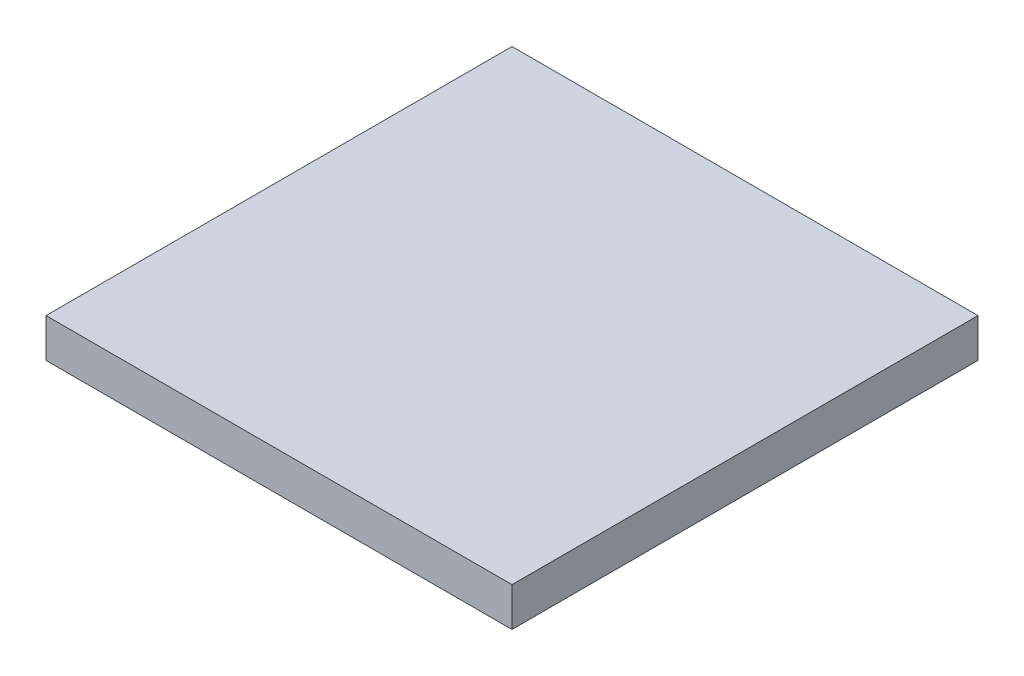
from build123d import *

# Parameters (mm, degrees)
SKETCH1_W           = 38.1
SKETCH1_H           = 38.1
BOSS_EXTRUDE1_DEPTH = 3.175


with BuildPart() as part:
    # Sketch1 → Boss-Extrude1 (new body)
    with BuildSketch(Plane(origin=(0, 0, 0), x_dir=(1, 0, 0), z_dir=(0, 1, 0))):
        Rectangle(SKETCH1_W, SKETCH1_H)
    extrude(amount=BOSS_EXTRUDE1_DEPTH)


solid = part.part
